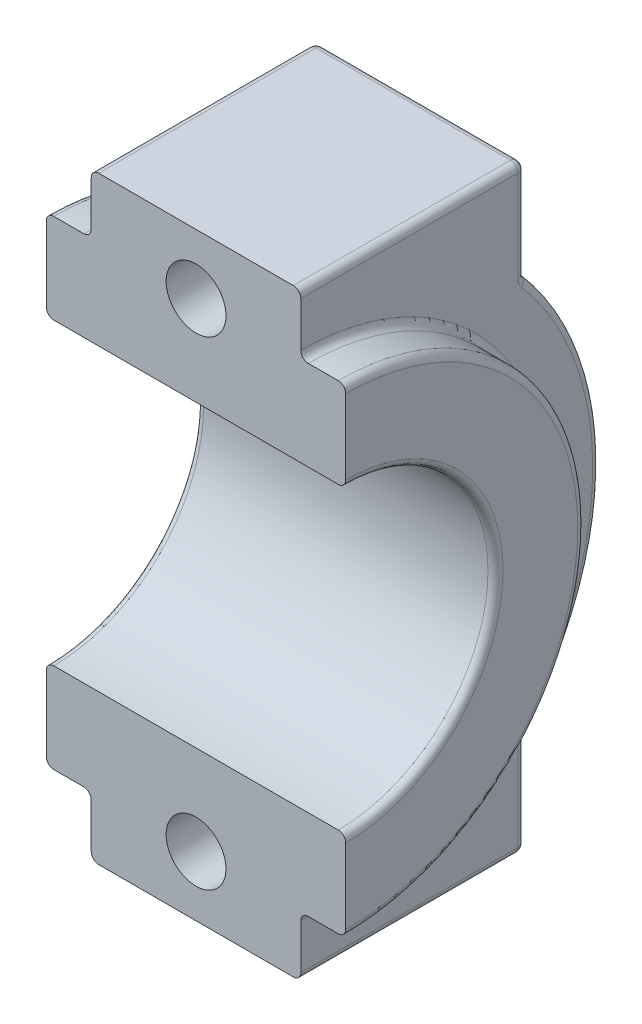
from build123d import *

# Parameters (mm, degrees)
BOSS_EXTRUDE1_DEPTH = 10
BOSS_EXTRUDE2_DEPTH = 7
SKETCH2_R           = 2
CUT_EXTRUDE1_DEPTH  = 15
FILLET1_R           = 0.5


with BuildPart() as part:
    # Sketch1 → Boss-Extrude1 (new, symmetric)
    with BuildSketch(Plane.YZ):
        with BuildLine():
            Line((-10, 7.5), (-16, 7.5))
            ThreePointArc((-16, 7.5), (0, -8.5), (16, 7.5))
            Line((16, 7.5), (10, 7.5))
            ThreePointArc((10, 7.5), (0, -2.5), (-10, 7.5))
        make_face()
    extrude(amount=BOSS_EXTRUDE1_DEPTH, both=True)

    # Sketch1<3> → Boss-Extrude2 (add, symmetric)
    with BuildSketch(Plane.YZ):
        with BuildLine():
            Line((-16, 7.5), (-20, 7.5))
            Line((-20, 7.5), (-20, -7.5))
            Line((-20, -7.5), (-13.228756555, -7.5))
            ThreePointArc((-13.228756555, -7.5), (0, -12.5), (13.228756555, -7.5))
            Line((13.228756555, -7.5), (20, -7.5))
            Line((20, -7.5), (20, 7.5))
            Line((20, 7.5), (16, 7.5))
            ThreePointArc((16, 7.5), (0, -8.5), (-16, 7.5))
        make_face()
    extrude(amount=BOSS_EXTRUDE2_DEPTH, both=True)

    # Sketch2 → Cut-Extrude1 (cut)
    with BuildSketch(Plane.XY.offset(7.5)):
        with Locations((0, 16)):
            Circle(SKETCH2_R)
        with Locations((0, -16)):
            Circle(SKETCH2_R)
    extrude(amount=-CUT_EXTRUDE1_DEPTH, mode=Mode.SUBTRACT)

    # Fillet1
    fillet1_edges = [part.edges().sort_by_distance(p)[0] for p in [
        (-7, 0, -12.5),
        (0, 13.228756555, -7.5),
        (-7, 16.614378278, -7.5),
        (0, -13.228756555, -7.5),
        (7, 0, -12.5),
        (-7, -16.614378278, -7.5),
        (0, 20, -7.5),
        (7, 16.614378278, -7.5),
        (-7, 20, 0),
        (7, -16.614378278, -7.5),
        (0, -20, -7.5),
        (-7, -20, 0),
        (7, 20, 0),
        (7, -20, 0),
        (-7, 0, -8.5),
        (7, 0, -8.5),
        (-10, 0, -8.5),
        (10, 0, -8.5),
        (-10, 0, -2.5),
        (10, 0, -2.5),
    ]]
    fillet(fillet1_edges, radius=FILLET1_R)


solid = part.part
